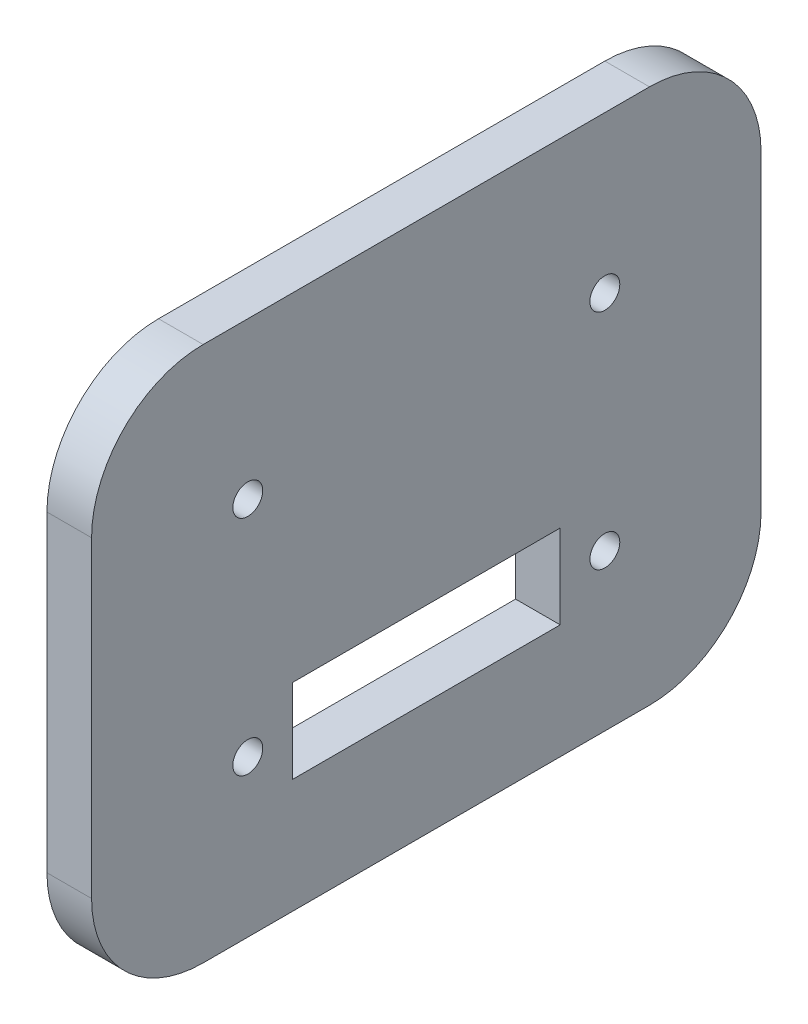
from build123d import *

# Parameters (mm, degrees)
SKETCH1_W               = 38.1
SKETCH1_H               = 30.48
BOSS_EXTRUDE1_DEPTH     = 2.54
SKETCH2_R               = 0.8509
CUT_EXTRUDE1_DEPTH      = 2.54
MIRROR2_COPY_1_SKETCH_R = 0.8509
MIRROR2_COPY_1_DEPTH    = 2.54
FILLET1_R               = 6.35
SKETCH3_W               = 15.24
SKETCH3_H               = 4.7752
CUT_EXTRUDE2_DEPTH      = 2.54


with BuildPart() as part:
    # Sketch1 → Boss-Extrude1 (new body)
    with BuildSketch(Plane(origin=(0, 0, 0), x_dir=(0, 0, -1), z_dir=(1, 0, 0))):
        Rectangle(SKETCH1_W, SKETCH1_H)
    extrude(amount=BOSS_EXTRUDE1_DEPTH)

    # Sketch2 → Cut-Extrude1 (cut)
    with BuildSketch(Plane(origin=(2.54, 0, 0), x_dir=(0, 0, -1), z_dir=(1, 0, 0))):
        with Locations((10.16, 6.35)):
            Circle(SKETCH2_R)
    cut_extrude1 = extrude(amount=-CUT_EXTRUDE1_DEPTH, mode=Mode.SUBTRACT)

    # Mirror1: Cut-Extrude1 across plane
    add(cut_extrude1.mirror(Plane.XY), mode=Mode.SUBTRACT)

    # Mirror2: Cut-Extrude1 across plane
    add(cut_extrude1.mirror(Plane.ZX), mode=Mode.SUBTRACT)

    # Mirror2 copy 1 sketch → Mirror2 copy 1 (cut)
    with BuildSketch(Plane(origin=(2.54, 0, 0), x_dir=(0, 0, 1), z_dir=(1, 0, 0))):
        with Locations((10.16, 6.35)):
            Circle(MIRROR2_COPY_1_SKETCH_R)
    extrude(amount=-MIRROR2_COPY_1_DEPTH, mode=Mode.SUBTRACT)

    # Fillet1
    fillet1_edges = [part.edges().sort_by_distance(p)[0] for p in [
        (1.27, -15.24, -19.05),
        (1.27, -15.24, 19.05),
        (1.27, 15.24, 19.05),
        (1.27, 15.24, -19.05),
    ]]
    fillet(fillet1_edges, radius=FILLET1_R)

    # Sketch3 → Cut-Extrude2 (cut)
    with BuildSketch(Plane(origin=(2.54, 0, 0), x_dir=(0, 0, -1), z_dir=(1, 0, 0))):
        with Locations((0, -6.35)):
            Rectangle(SKETCH3_W, SKETCH3_H)
    extrude(amount=-CUT_EXTRUDE2_DEPTH, mode=Mode.SUBTRACT)


solid = part.part
